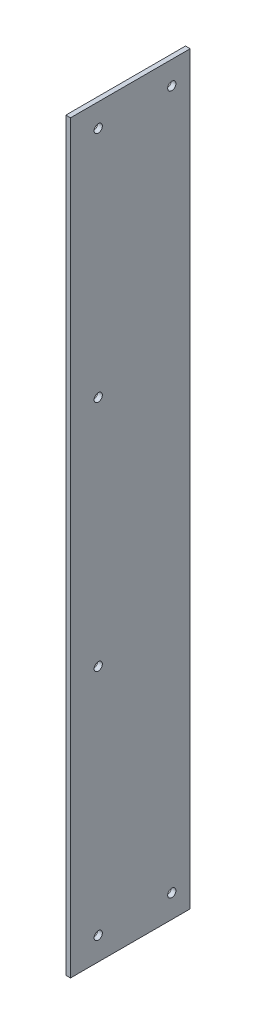
from build123d import *

# Parameters (mm, degrees)
SKETCH1_W           = 500
SKETCH1_H           = 75
SKETCH1_R           = 2.8
BOSS_EXTRUDE1_DEPTH = 3.175
SKETCH2_W           = 500
SKETCH2_H           = 6.35
BOSS_EXTRUDE2_DEPTH = 3.175


with BuildPart() as part:
    # Sketch1 → Boss-Extrude1 (new body)
    # profile 1 of 3: a face of its own
    with BuildSketch(Plane.YZ):
        Rectangle(SKETCH1_W, SKETCH1_H)
        with Locations(Location((-237.5, -25, 0), (0, 0, 270))):
            Circle(SKETCH1_R, mode=Mode.SUBTRACT)
        with Locations(Location((237.49999999, -25, 0), (0, 0, 270))):
            Circle(SKETCH1_R, mode=Mode.SUBTRACT)
        with Locations((79.16666666, -25)):
            Circle(SKETCH1_R, mode=Mode.SUBTRACT)
        with Locations((-79.16666667, -25)):
            Circle(SKETCH1_R, mode=Mode.SUBTRACT)
        with Locations(Location((237.49999999, 25, 0), (0, 0, 270))):
            Circle(SKETCH1_R, mode=Mode.SUBTRACT)
        with Locations(Location((79.16666666, 25, 0), (0, 0, 270))):
            Circle(SKETCH1_R, mode=Mode.SUBTRACT)
        with Locations(Location((-79.16666667, 25, 0), (0, 0, 270))):
            Circle(SKETCH1_R, mode=Mode.SUBTRACT)
        with Locations(Location((-237.5, 25, 0), (0, 0, 270))):
            Circle(SKETCH1_R, mode=Mode.SUBTRACT)
    # profile 2 of 3: a face of its own
    with BuildSketch(Plane.YZ):
        with Locations((-79.16666667, -25)):
            Circle(SKETCH1_R)
    # profile 3 of 3: a face of its own
    with BuildSketch(Plane.YZ):
        with Locations((79.16666666, -25)):
            Circle(SKETCH1_R)
    extrude(amount=BOSS_EXTRUDE1_DEPTH)

    # Sketch2 → Boss-Extrude2 (add, through all)
    with BuildSketch(Plane.YZ.offset(3.175)):
        Polygon((-253.175, -37.5), (-250, -37.5), (-250, 37.5), (-250, 43.85), (-253.175, 43.85), align=None)
        with Locations((0, 40.675)):
            Rectangle(SKETCH2_W, SKETCH2_H)
        Polygon((250, 43.85), (250, 37.5), (250, -37.5), (253.175, -37.5), (253.175, 43.85), align=None)
    extrude(amount=-BOSS_EXTRUDE2_DEPTH)


solid = part.part
